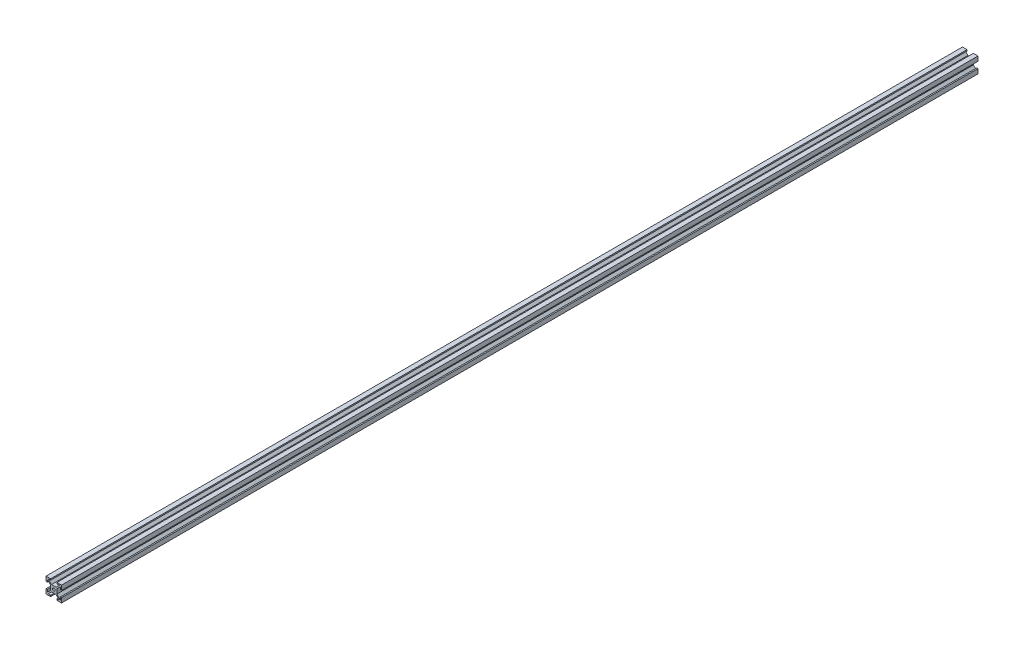
from build123d import *

# Parameters (mm, degrees)
SKETCH1_R           = 1.77
BOSS_EXTRUDE1_DEPTH = 1180


with BuildPart() as part:
    # Sketch1 → Boss-Extrude1 (new body)
    with BuildSketch(Plane.XY):
        Polygon((-8.38, 4.1), (-10, 4.1), (-10, 10), (-4.1, 10), (-4.1, 8.38), (-7.234487014, 8.38), (-2.954487014, 4.1), (2.954487014, 4.1), (7.234487014, 8.38), (4.1, 8.38), (4.1, 10), (10, 10), (10, 4.1), (8.38, 4.1), (8.38, 7.234487014), (4.1, 2.954487014), (4.1, -2.954487014), (8.38, -7.234487014), (8.38, -4.1), (10, -4.1), (10, -10), (4.1, -10), (4.1, -8.38), (7.234487014, -8.38), (2.954487014, -4.1), (-2.954487014, -4.1), (-7.234487014, -8.38), (-4.1, -8.38), (-4.1, -10), (-10, -10), (-10, -4.1), (-8.38, -4.1), (-8.38, -7.234487014), (-4.1, -2.954487014), (-4.1, 2.954487014), (-8.38, 7.234487014), align=None)
        Circle(SKETCH1_R, mode=Mode.SUBTRACT)
    extrude(amount=BOSS_EXTRUDE1_DEPTH)


solid = part.part
